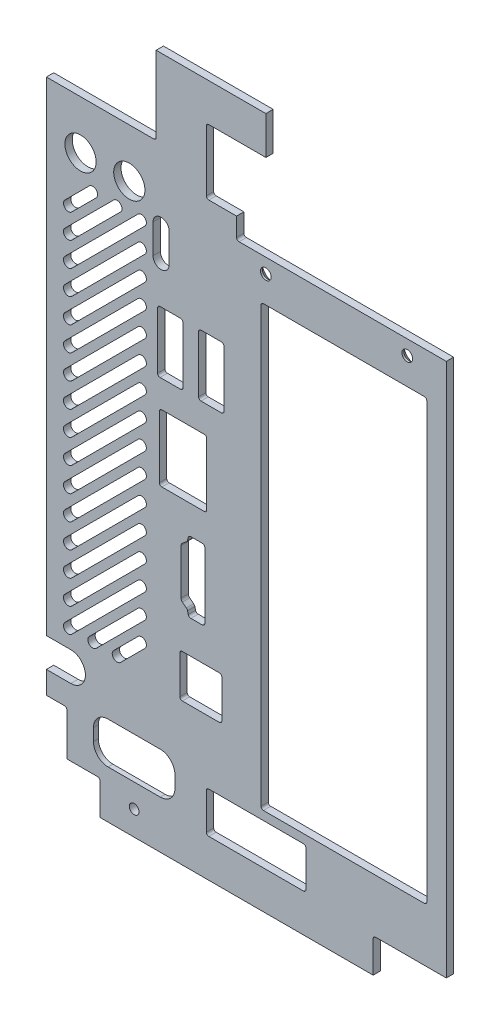
from build123d import *

# Parameters (mm, degrees)
SKETCH_1_W               = 86
SKETCH_1_H               = 152
EXTRUDE_1_DEPTH          = 1.5
SKETCH_36_OUTSIDE_W      = 122.93
SKETCH_36_OUTSIDE_H      = 188.93
SKETCH_36_OUTSIDE_W_2    = 82
SKETCH_36_OUTSIDE_H_2    = 142
IO_2_DEPTH               = 10
SKETCH_38_W              = 20
SKETCH_38_H              = 8
SKETCH_38_W_2            = 22.5
SKETCH_38_H_2            = 16
SKETCH_38_W_3            = 11
SKETCH_38_H_3            = 17
SKETCH_38_W_4            = 15
SKETCH_38_H_4            = 7
SKETCH_38_W_5            = 23.4
SKETCH_38_H_5            = 13.4
CUT_EXTRUDE_7473_DEPTH   = 10
SKETCH_7_W               = 8.6
SKETCH_7_H               = 8.79341608
SKETCH_7_W_2             = 9.7
SKETCH_7_H_2             = 13.7
SKETCH_7_W_3             = 5.2
SKETCH_7_H_3             = 12.6
NUC_IO_DEPTH             = 2
SKETCH_25_R              = 1
SKETCH_25_W              = 41
SKETCH_25_H              = 7.5
SKETCH_25_W_2            = 34
SKETCH_25_H_2            = 90
PCI_E_DEPTH              = 10
SKETCH_31_R              = 1
POWER_DEPTH              = 10
CUT_EXTRUDE_14484_DEPTH  = 2
CUT_EXTRUDE_1_DEPTH      = 10
SKETCH_54_R              = 3.2
SMA_DEPTH                = 1.5
HOLE_WIZARD_1_AT_2_COUNT = 2
HOLE_WIZARD_1_AT_2_PITCH = 29
SKETCH_57_W              = 20.4
SKETCH_57_H              = 8.4
CUT_EXTRUDE_4_DEPTH      = 10
FILLET_1_R               = 0.5
SKETCH_59_W              = 20
SKETCH_59_H              = 12
CUT_EXTRUDE_5_DEPTH      = 0.5
FILLET_3_R               = 0.5
CUT_EXTRUDE_7_DEPTH      = 10
FILLET_4_R               = 0.5
FILLET_5_R               = 0.5


with BuildPart() as part:
    # 草图1 → 凸台-拉伸1 (new body)
    with BuildSketch(Plane.XY):
        with Locations((-133.124844198, 203.722414953)):
            Rectangle(SKETCH_1_W, SKETCH_1_H)
    extrude(amount=EXTRUDE_1_DEPTH)

    # 草图36 outside → IO 2 (cut)
    with BuildSketch(Plane.XY.offset(1.5)):
        with Locations((-133.125, 203.722)):
            Rectangle(SKETCH_36_OUTSIDE_W, SKETCH_36_OUTSIDE_H)
        with Locations((-131.124844198, 203.722414953)):
            Rectangle(SKETCH_36_OUTSIDE_W_2, SKETCH_36_OUTSIDE_H_2, mode=Mode.SUBTRACT)
    extrude(amount=-IO_2_DEPTH, mode=Mode.SUBTRACT)

    # 草图38 → Cut-Extrude 7473 (cut)
    with BuildSketch(Plane(origin=(0, 0, 0), x_dir=(-1, 0, 0), z_dir=(0, 0, -1))):
        Polygon((167.924844198, 148.922414953), (167.924844198, 139.722414953), (161.124844198, 139.722414953), (161.124844198, 132.722414953), (172.124844198, 132.722414953), (172.124844198, 148.922414953), align=None)
        with Locations((129.124844198, 144.722414953)):
            Rectangle(SKETCH_38_W, SKETCH_38_H)
        with Locations((160.874844198, 266.722414953)):
            Rectangle(SKETCH_38_W_2, SKETCH_38_H_2)
        with Locations((95.624844198, 266.222414953)):
            Rectangle(SKETCH_38_W_3, SKETCH_38_H_3)
        with Locations((97.624844198, 136.222414953)):
            Rectangle(SKETCH_38_W_4, SKETCH_38_H_4)
        with Locations((127.624844198, 260.222414953)):
            Rectangle(SKETCH_38_W_5, SKETCH_38_H_5)
    extrude(amount=-CUT_EXTRUDE_7473_DEPTH, mode=Mode.SUBTRACT)

    # 草图7 → NUC-IO (cut)
    with BuildSketch(Plane.XY.offset(1.5)):
        with Locations((-140.449866796, 166.247685127)):
            Rectangle(SKETCH_7_W, SKETCH_7_H)
        with Locations((-144.099866796, 204.607685132)):
            Rectangle(SKETCH_7_W_2, SKETCH_7_H_2)
        with Locations((-146.724844198, 223.322414953)):
            Rectangle(SKETCH_7_W_3, SKETCH_7_H_3)
        with Locations((-138.324844198, 223.322414953)):
            Rectangle(SKETCH_7_W_3, SKETCH_7_H_3)
        with BuildLine():
            Line((-143.43313941, 190.515993574), (-144.219329814, 189.887979078))
            ThreePointArc((-144.219329814, 189.887979078), (-144.42709415, 189.627124012), (-144.501235033, 189.301986328))
            Line((-144.501235033, 189.301986328), (-144.501235033, 180.001986328))
            ThreePointArc((-144.501235033, 180.001986328), (-144.427094168, 179.676848683), (-144.219329881, 179.415993634))
            Line((-144.219329881, 179.415993634), (-143.433139457, 178.787978978))
            ThreePointArc((-143.433139457, 178.787978978), (-143.269315762, 178.605940537), (-143.172869958, 178.380830777))
            Line((-143.172869958, 178.380830777), (-143.035367077, 177.82083422))
            ThreePointArc((-143.035367077, 177.82083422), (-142.840620042, 177.519186323), (-142.501234719, 177.40198793))
            Line((-142.501234719, 177.40198793), (-140.18608998, 177.40198793))
            ThreePointArc((-140.18608998, 177.40198793), (-139.79718247, 177.5630787), (-139.636091715, 177.951986216))
            Line((-139.636091715, 177.951986216), (-139.636092219, 191.351986317))
            ThreePointArc((-139.636092219, 191.351986317), (-139.797182657, 191.740893471), (-140.186089544, 191.901984552))
            Line((-140.186089544, 191.901984552), (-142.501234284, 191.901984552))
            ThreePointArc((-142.501234284, 191.901984552), (-142.840619335, 191.784786328), (-143.03536638, 191.48313881))
            Line((-143.03536638, 191.48313881), (-143.172869971, 190.923141277))
            ThreePointArc((-143.172869971, 190.923141277), (-143.269315822, 190.698031794), (-143.43313941, 190.515993574))
        make_face()
        with BuildLine():
            Line((-150.254844198, 243.922414953), (-150.254844198, 237.922414953))
            ThreePointArc((-150.254844198, 237.922414953), (-148.604844198, 236.272414953), (-146.954844198, 237.922414953))
            Line((-146.954844198, 237.922414953), (-146.954844198, 243.922414953))
            ThreePointArc((-146.954844198, 243.922414953), (-148.604844198, 245.572414953), (-150.254844198, 243.922414953))
        make_face()
    extrude(amount=-NUC_IO_DEPTH, mode=Mode.SUBTRACT)

    # 草图25 → PCI-E (cut)
    with BuildSketch(Plane.XY.offset(1.5)):
        with Locations((-98.124844198, 246.222414953)):
            Circle(SKETCH_25_R)
        with Locations((-127.124844198, 246.222414953)):
            Circle(SKETCH_25_R)
        with Locations((-112.624844198, 252.972414953)):
            Rectangle(SKETCH_25_W, SKETCH_25_H)
        with Locations((-111.124844198, 195.722414953)):
            Rectangle(SKETCH_25_W_2, SKETCH_25_H_2)
    extrude(amount=-PCI_E_DEPTH, mode=Mode.SUBTRACT)

    # 草图31 → Power (cut)
    with BuildSketch(Plane.XY.offset(1.5)):
        with Locations((-154.124844198, 137.722414953)):
            Circle(SKETCH_31_R)
        with BuildLine():
            Line((-162.474844198, 148.022414953), (-162.474844198, 145.522414953))
            ThreePointArc((-162.474844198, 145.522414953), (-161.596164541, 143.40109461), (-159.474844198, 142.522414953))
            Line((-159.474844198, 142.522414953), (-148.774844198, 142.522414953))
            ThreePointArc((-148.774844198, 142.522414953), (-146.653523854, 143.40109461), (-145.774844198, 145.522414953))
            Line((-145.774844198, 145.522414953), (-145.774844198, 148.022414953))
            ThreePointArc((-145.774844198, 148.022414953), (-146.653523854, 150.143735297), (-148.774844198, 151.022414953))
            Line((-148.774844198, 151.022414953), (-159.474844198, 151.022414953))
            ThreePointArc((-159.474844198, 151.022414953), (-161.596164541, 150.143735297), (-162.474844198, 148.022414953))
        make_face()
    extrude(amount=-POWER_DEPTH, mode=Mode.SUBTRACT)

    # 草图46 → Cut-Extrude 14484 (cut)
    with BuildSketch(Plane.XY.offset(1.5)):
        with BuildLine():
            Line((-177.300475837, 159.522414953), (-167.124844198, 159.522414953))
            ThreePointArc((-167.124844198, 159.522414953), (-164.124844198, 156.522414953), (-167.124844198, 153.522414953))
            Line((-167.124844198, 153.522414953), (-177.300475837, 153.522414953))
            ThreePointArc((-177.300475837, 153.522414953), (-180.300475837, 156.522414953), (-177.300475837, 159.522414953))
        make_face()
    extrude(amount=-CUT_EXTRUDE_14484_DEPTH, mode=Mode.SUBTRACT)

    # 草图48 → 切除-拉伸1 (cut)
    with BuildSketch(Plane(origin=(0, 0, 0), x_dir=(-1, 0, 0), z_dir=(0, 0, -1))):
        Polygon((133.124844198, 259.889141126), (127.124844198, 259.889141126), (127.124844198, 275.739655242), (90.124844198, 275.739655242), (90.124844198, 249.222414953), (133.124844198, 249.222414953), align=None)
    extrude(amount=-CUT_EXTRUDE_1_DEPTH, mode=Mode.SUBTRACT)

    # 草图54 → SMA (cut)
    with BuildSketch(Plane.XY.offset(1.5)):
        with Locations((-155.124844198, 248.722414953)):
            Circle(SKETCH_54_R)
        with Locations((-165.124844198, 248.722414953)):
            Circle(SKETCH_54_R)
    extrude(amount=-SMA_DEPTH, mode=Mode.SUBTRACT)

    # 草图56 → Hole Wizard 1 (revolve, cut)
    with BuildSketch(Plane(origin=(-98.124844198, 246.222414953, 0), x_dir=(0, 1, 0), z_dir=(1, 0, 0))):
        Polygon((0, 0), (0, 1.5), (1.1, 1.5), (1.1, 1.1), (2.2, 0), align=None)
    hole_wizard_1 = revolve(axis=Axis((-98.124844198, 246.222414953, -6.35), (0, 0, 1)), mode=Mode.SUBTRACT)

    # Hole Wizard 1 at 2: Hole Wizard 1 ×2
    with Locations(*[(-i * HOLE_WIZARD_1_AT_2_PITCH, 0, 0) for i in range(1, HOLE_WIZARD_1_AT_2_COUNT)]):
        add(hole_wizard_1, mode=Mode.SUBTRACT)

    # 草图57 → 切除-拉伸4 (cut)
    with BuildSketch(Plane(origin=(0, 0, 0), x_dir=(-1, 0, 0), z_dir=(0, 0, -1))):
        with Locations((129.124844198, 144.722414953)):
            Rectangle(SKETCH_57_W, SKETCH_57_H)
    extrude(amount=-CUT_EXTRUDE_4_DEPTH, mode=Mode.SUBTRACT)

    # 圆角1
    fillet_1_edges = [part.edges().sort_by_distance(p)[0] for p in [
        (-139.324844198, 253.522414953, 0.75),
        (-139.324844198, 266.922414953, 0.75),
        (-167.924844198, 148.922414953, 0.75),
        (-139.324844198, 140.522414953, 0.75),
        (-118.924844198, 140.522414953, 0.75),
        (-139.324844198, 148.922414953, 0.75),
        (-118.924844198, 148.922414953, 0.75),
    ]]
    fillet(fillet_1_edges, radius=FILLET_1_R)

    # 草图59 → 切除-拉伸5 (cut)
    with BuildSketch(Plane(origin=(0, 0, 0), x_dir=(-1, 0, 0), z_dir=(0, 0, -1))):
        with Locations((154.124844198, 146.772414953)):
            Rectangle(SKETCH_59_W, SKETCH_59_H)
    extrude(amount=-CUT_EXTRUDE_5_DEPTH, mode=Mode.SUBTRACT)

    # 圆角3
    fillet_3_edges = [part.edges().sort_by_distance(p)[0] for p in [
        (-144.124844198, 140.772414953, 0.25),
        (-164.124844198, 140.772414953, 0.25),
        (-164.124844198, 152.772414953, 0.25),
        (-144.124844198, 152.772414953, 0.25),
    ]]
    fillet(fillet_3_edges, radius=FILLET_3_R)

    # 草图62 → 切除-拉伸7 (cut)
    with BuildSketch(Plane.XY.offset(1.5)):
        with BuildLine():
            Line((-168.331950979, 163.772590893), (-153.331950979, 178.772590893))
            ThreePointArc((-153.331950979, 178.772590893), (-151.917737416, 178.772590893), (-151.917737416, 177.358377331))
            Line((-151.917737416, 177.358377331), (-166.917737416, 162.358377331))
            ThreePointArc((-166.917737416, 162.358377331), (-168.331950979, 162.358377331), (-168.331950979, 163.772590893))
        make_face()
        with BuildLine():
            Line((-168.331950979, 168.772590893), (-153.331950979, 183.772590893))
            ThreePointArc((-153.331950979, 183.772590893), (-151.917737416, 183.772590893), (-151.917737416, 182.358377331))
            Line((-151.917737416, 182.358377331), (-166.917737416, 167.358377331))
            ThreePointArc((-166.917737416, 167.358377331), (-168.331950979, 167.358377331), (-168.331950979, 168.772590893))
        make_face()
        with BuildLine():
            Line((-168.331950979, 173.772590893), (-153.331950979, 188.772590893))
            ThreePointArc((-153.331950979, 188.772590893), (-151.917737416, 188.772590893), (-151.917737416, 187.358377331))
            Line((-151.917737416, 187.358377331), (-166.917737416, 172.358377331))
            ThreePointArc((-166.917737416, 172.358377331), (-168.331950979, 172.358377331), (-168.331950979, 173.772590893))
        make_face()
        with BuildLine():
            Line((-168.331950979, 178.772590893), (-153.331950979, 193.772590893))
            ThreePointArc((-153.331950979, 193.772590893), (-151.917737416, 193.772590893), (-151.917737416, 192.358377331))
            Line((-151.917737416, 192.358377331), (-166.917737416, 177.358377331))
            ThreePointArc((-166.917737416, 177.358377331), (-168.331950979, 177.358377331), (-168.331950979, 178.772590893))
        make_face()
        with BuildLine():
            Line((-168.331950979, 183.772590893), (-153.331950979, 198.772590893))
            ThreePointArc((-153.331950979, 198.772590893), (-151.917737416, 198.772590893), (-151.917737416, 197.358377331))
            Line((-151.917737416, 197.358377331), (-166.917737416, 182.358377331))
            ThreePointArc((-166.917737416, 182.358377331), (-168.331950979, 182.358377331), (-168.331950979, 183.772590893))
        make_face()
        with BuildLine():
            Line((-168.331950979, 188.772590893), (-153.331950979, 203.772590893))
            ThreePointArc((-153.331950979, 203.772590893), (-151.917737416, 203.772590893), (-151.917737416, 202.358377331))
            Line((-151.917737416, 202.358377331), (-166.917737416, 187.358377331))
            ThreePointArc((-166.917737416, 187.358377331), (-168.331950979, 187.358377331), (-168.331950979, 188.772590893))
        make_face()
        with BuildLine():
            Line((-168.331950979, 193.772590893), (-153.331950979, 208.772590893))
            ThreePointArc((-153.331950979, 208.772590893), (-151.917737416, 208.772590893), (-151.917737416, 207.358377331))
            Line((-151.917737416, 207.358377331), (-166.917737416, 192.358377331))
            ThreePointArc((-166.917737416, 192.358377331), (-168.331950979, 192.358377331), (-168.331950979, 193.772590893))
        make_face()
        with BuildLine():
            Line((-168.331950979, 198.772590893), (-153.331950979, 213.772590893))
            ThreePointArc((-153.331950979, 213.772590893), (-151.917737416, 213.772590893), (-151.917737416, 212.358377331))
            Line((-151.917737416, 212.358377331), (-166.917737416, 197.358377331))
            ThreePointArc((-166.917737416, 197.358377331), (-168.331950979, 197.358377331), (-168.331950979, 198.772590893))
        make_face()
        with BuildLine():
            Line((-168.331950979, 203.772590893), (-153.331950979, 218.772590893))
            ThreePointArc((-153.331950979, 218.772590893), (-151.917737416, 218.772590893), (-151.917737416, 217.358377331))
            Line((-151.917737416, 217.358377331), (-166.917737416, 202.358377331))
            ThreePointArc((-166.917737416, 202.358377331), (-168.331950979, 202.358377331), (-168.331950979, 203.772590893))
        make_face()
        with BuildLine():
            Line((-168.331950979, 208.772590893), (-153.331950979, 223.772590893))
            ThreePointArc((-153.331950979, 223.772590893), (-151.917737416, 223.772590893), (-151.917737416, 222.358377331))
            Line((-151.917737416, 222.358377331), (-166.917737416, 207.358377331))
            ThreePointArc((-166.917737416, 207.358377331), (-168.331950979, 207.358377331), (-168.331950979, 208.772590893))
        make_face()
        with BuildLine():
            Line((-168.331950979, 213.772590893), (-153.331950979, 228.772590893))
            ThreePointArc((-153.331950979, 228.772590893), (-151.917737416, 228.772590893), (-151.917737416, 227.358377331))
            Line((-151.917737416, 227.358377331), (-166.917737416, 212.358377331))
            ThreePointArc((-166.917737416, 212.358377331), (-168.331950979, 212.358377331), (-168.331950979, 213.772590893))
        make_face()
        with BuildLine():
            Line((-168.331950979, 218.772590893), (-153.331950979, 233.772590893))
            ThreePointArc((-153.331950979, 233.772590893), (-151.917737416, 233.772590893), (-151.917737416, 232.358377331))
            Line((-151.917737416, 232.358377331), (-166.917737416, 217.358377331))
            ThreePointArc((-166.917737416, 217.358377331), (-168.331950979, 217.358377331), (-168.331950979, 218.772590893))
        make_face()
        with BuildLine():
            Line((-168.331950979, 223.772590893), (-153.331950979, 238.772590893))
            ThreePointArc((-153.331950979, 238.772590893), (-151.917737416, 238.772590893), (-151.917737416, 237.358377331))
            Line((-151.917737416, 237.358377331), (-166.917737416, 222.358377331))
            ThreePointArc((-166.917737416, 222.358377331), (-168.331950979, 222.358377331), (-168.331950979, 223.772590893))
        make_face()
        with BuildLine():
            Line((-168.331950979, 228.772590893), (-153.331950979, 243.772590893))
            ThreePointArc((-153.331950979, 243.772590893), (-151.917737416, 243.772590893), (-151.917737416, 242.358377331))
            Line((-151.917737416, 242.358377331), (-166.917737416, 227.358377331))
            ThreePointArc((-166.917737416, 227.358377331), (-168.331950979, 227.358377331), (-168.331950979, 228.772590893))
        make_face()
        with BuildLine():
            Line((-163.331950979, 163.772590893), (-153.331950979, 173.772590893))
            ThreePointArc((-153.331950979, 173.772590893), (-151.917737416, 173.772590893), (-151.917737416, 172.358377331))
            Line((-151.917737416, 172.358377331), (-161.917737416, 162.358377331))
            ThreePointArc((-161.917737416, 162.358377331), (-163.331950979, 162.358377331), (-163.331950979, 163.772590893))
        make_face()
        with BuildLine():
            Line((-151.917737416, 167.358377331), (-156.917737416, 162.358377331))
            ThreePointArc((-156.917737416, 162.358377331), (-158.331950979, 162.358377331), (-158.331950979, 163.772590893))
            Line((-158.331950979, 163.772590893), (-153.331950979, 168.772590893))
            ThreePointArc((-153.331950979, 168.772590893), (-151.917737416, 168.772590893), (-151.917737416, 167.358377331))
        make_face()
        with BuildLine():
            Line((-156.917737416, 242.358377331), (-166.917737416, 232.358377331))
            ThreePointArc((-166.917737416, 232.358377331), (-168.331950979, 232.358377331), (-168.331950979, 233.772590893))
            Line((-168.331950979, 233.772590893), (-158.331950979, 243.772590893))
            ThreePointArc((-158.331950979, 243.772590893), (-156.917737416, 243.772590893), (-156.917737416, 242.358377331))
        make_face()
        with BuildLine():
            Line((-161.917737416, 242.358377331), (-166.917737416, 237.358377331))
            ThreePointArc((-166.917737416, 237.358377331), (-168.331950979, 237.358377331), (-168.331950979, 238.772590893))
            Line((-168.331950979, 238.772590893), (-163.331950979, 243.772590893))
            ThreePointArc((-163.331950979, 243.772590893), (-161.917737416, 243.772590893), (-161.917737416, 242.358377331))
        make_face()
    extrude(amount=-CUT_EXTRUDE_7_DEPTH, mode=Mode.SUBTRACT)

    # 圆角4
    fillet_4_edges = [part.edges().sort_by_distance(p)[0] for p in [
        (-161.124844198, 139.722414953, 0.75),
        (-105.124844198, 139.722414953, 0.75),
        (-128.124844198, 150.722414953, 0.75),
        (-94.124844198, 150.722414953, 0.75),
        (-94.124844198, 240.722414953, 0.75),
        (-128.124844198, 240.722414953, 0.75),
        (-133.124844198, 249.222414953, 0.75),
        (-149.624844198, 258.722414953, 0.75),
    ]]
    fillet(fillet_4_edges, radius=FILLET_4_R)

    # 圆角5
    fillet_5_edges = [part.edges().sort_by_distance(p)[0] for p in [
        (-144.124844198, 217.022414953, 0.75),
        (-140.924844198, 217.022414953, 0.75),
        (-149.324844198, 217.022414953, 0.75),
        (-144.124844198, 229.622414953, 0.75),
        (-149.324844198, 229.622414953, 0.75),
        (-140.924844198, 229.622414953, 0.75),
        (-135.724844198, 229.622414953, 0.75),
        (-135.724844198, 217.022414953, 0.75),
        (-148.949866796, 197.757685132, 0.75),
        (-139.249866796, 197.757685132, 0.75),
        (-139.249866796, 211.457685132, 0.75),
        (-148.949866796, 211.457685132, 0.75),
        (-144.749866796, 161.850977087, 0.75),
        (-136.149866796, 161.850977087, 0.75),
        (-136.149866796, 170.644393167, 0.75),
        (-144.749866796, 170.644393167, 0.75),
    ]]
    fillet(fillet_5_edges, radius=FILLET_5_R)


solid = part.part
